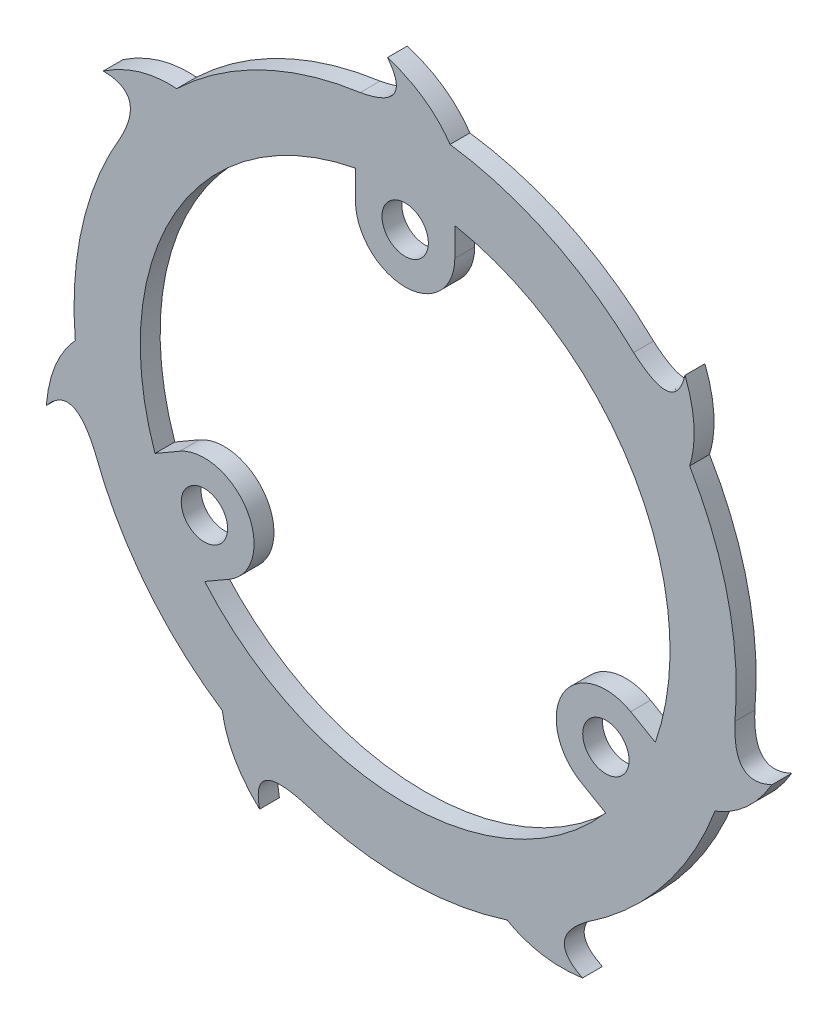
from build123d import *

# Parameters (mm, degrees)
SKETCH1_R           = 1.778
BOSS_EXTRUDE1_DEPTH = 1.524
BOSS_EXTRUDE2_DEPTH = 1.524


with BuildPart() as part:
    # Sketch1 → Boss-Extrude1 (new body)
    with BuildSketch(Plane.XY):
        with BuildLine():
            ThreePointArc((21.997045256, 12.7), (0, 25.4), (-21.997045256, 12.7))
            ThreePointArc((-21.997045256, 12.7), (-21.997045256, -12.7), (0, -25.4))
            ThreePointArc((0, -25.4), (21.997045256, -12.7), (21.997045256, 12.7))
        make_face()
        with Locations(Location((0, 17.78, 0), (0, 0, 180))):
            Circle(SKETCH1_R, mode=Mode.SUBTRACT)
        with Locations(Location((15.397931679, -8.89, 0), (0, 0, 180))):
            Circle(SKETCH1_R, mode=Mode.SUBTRACT)
        with Locations(Location((-15.397931679, -8.89, 0), (0, 0, 180))):
            Circle(SKETCH1_R, mode=Mode.SUBTRACT)
        with BuildLine():
            Line((-3.81, 17.78), (-3.81, 19.95961673))
            ThreePointArc((-3.81, 19.95961673), (-11.771994053, 16.562685652), (-17.597636205, 10.16))
            ThreePointArc((-17.597636205, 10.16), (-20.229703556, 1.913503077), (-19.190535138, -6.680251576))
            Line((-19.190535138, -6.680251576), (-17.302931679, -5.590443212))
            ThreePointArc((-17.302931679, -5.590443212), (-12.098374891, -6.985), (-13.492931679, -12.189556788))
            Line((-13.492931679, -12.189556788), (-15.380535138, -13.279365153))
            ThreePointArc((-15.380535138, -13.279365153), (-8.457709503, -18.476188729), (0, -20.32))
            ThreePointArc((0, -20.32), (8.457709503, -18.476188729), (15.380535138, -13.279365153))
            Line((15.380535138, -13.279365153), (13.492931679, -12.189556788))
            ThreePointArc((13.492931679, -12.189556788), (12.098374891, -6.985), (17.302931679, -5.590443212))
            Line((17.302931679, -5.590443212), (19.190535138, -6.680251576))
            ThreePointArc((19.190535138, -6.680251576), (20.229703556, 1.913503077), (17.597636205, 10.16))
            ThreePointArc((17.597636205, 10.16), (11.771994053, 16.562685652), (3.81, 19.95961673))
            Line((3.81, 19.95961673), (3.81, 17.78))
            ThreePointArc((3.81, 17.78), (0, 13.97), (-3.81, 17.78))
        make_face(mode=Mode.SUBTRACT)
    extrude(amount=BOSS_EXTRUDE1_DEPTH)

    # Sketch2 → Boss-Extrude2 (add)
    with BuildSketch(Plane.XY.offset(1.524)):
        with BuildLine():
            Line((-3.444175737, 25.165405888), (4.388245609, 23.329352482))
            add(Edge.make_bspline(
                [(-1.351467981, 28.543022953), (2.94701041, 27.179254576), (4.388245609, 23.329352482)],
                knots=[0, 0, 0, 1, 1, 1], degree=2))
            add(Edge.make_bspline(
                [(-1.351467981, 28.543022953), (0.693484877, 25.920519128), (-3.444175737, 25.165405888)],
                knots=[0, 0, 0, 1, 1, 1], degree=2))
        make_face()
        with BuildLine():
            Line((17.527698145, 18.383138953), (20.975648621, 11.114744787))
            add(Edge.make_bspline(
                [(21.473207446, 18.852903941), (23.087027834, 14.641922533), (20.975648621, 11.114744787)],
                knots=[0, 0, 0, 1, 1, 1], degree=2))
            add(Edge.make_bspline(
                [(21.473207446, 18.852903941), (20.697858644, 15.618991025), (17.527698145, 18.383138953)],
                knots=[0, 0, 0, 1, 1, 1], degree=2))
        make_face()
        with BuildLine():
            Line((25.300857823, -2.242006562), (21.767960397, -9.469492432))
            add(Edge.make_bspline(
                [(28.128119692, -5.033836268), (25.84204241, -8.921075819), (21.767960397, -9.469492432)],
                knots=[0, 0, 0, 1, 1, 1], degree=2))
            add(Edge.make_bspline(
                [(28.128119692, -5.033836268), (25.116322693, -6.443955888), (25.300857823, -2.242006562)],
                knots=[0, 0, 0, 1, 1, 1], degree=2))
        make_face()
        with BuildLine():
            Line((14.021955517, -21.178875406), (6.168554008, -22.923008708))
            add(Edge.make_bspline(
                [(13.601984102, -25.129995095), (9.137471969, -25.766322122), (6.168554008, -22.923008708)],
                knots=[0, 0, 0, 1, 1, 1], degree=2))
            add(Edge.make_bspline(
                [(13.601984102, -25.129995095), (10.621683474, -23.654472585), (14.021955517, -21.178875406)],
                knots=[0, 0, 0, 1, 1, 1], degree=2))
        make_face()
        with BuildLine():
            Line((-7.815765289, -24.1676191), (-14.075899364, -19.115031882))
            add(Edge.make_bspline(
                [(-11.166722947, -26.302755058), (-14.447801235, -23.20900233), (-14.075899364, -19.115031882)],
                knots=[0, 0, 0, 1, 1, 1], degree=2))
            add(Edge.make_bspline(
                [(-11.166722947, -26.302755058), (-11.871300044, -23.052688962), (-7.815765289, -24.1676191)],
                knots=[0, 0, 0, 1, 1, 1], degree=2))
        make_face()
        with BuildLine():
            Line((-23.76805542, -8.957652682), (-23.72091342, -0.913046174))
            add(Edge.make_bspline(
                [(-27.526659857, -7.669003983), (-27.153585428, -3.174830406), (-23.72091342, -0.913046174)],
                knots=[0, 0, 0, 1, 1, 1], degree=2))
            add(Edge.make_bspline(
                [(-27.526659857, -7.669003983), (-25.424952498, -5.091760362), (-23.76805542, -8.957652682)],
                knots=[0, 0, 0, 1, 1, 1], degree=2))
        make_face()
        with BuildLine():
            Line((-21.82251504, 12.997608909), (-15.503595851, 17.976481926))
            add(Edge.make_bspline(
                [(-23.158460453, 16.73966351), (-19.412165961, 19.250053568), (-15.503595851, 17.976481926)],
                knots=[0, 0, 0, 1, 1, 1], degree=2))
            add(Edge.make_bspline(
                [(-23.158460453, 16.73966351), (-19.833097147, 16.703367644), (-21.82251504, 12.997608909)],
                knots=[0, 0, 0, 1, 1, 1], degree=2))
        make_face()
    extrude(amount=-BOSS_EXTRUDE2_DEPTH)


solid = part.part
